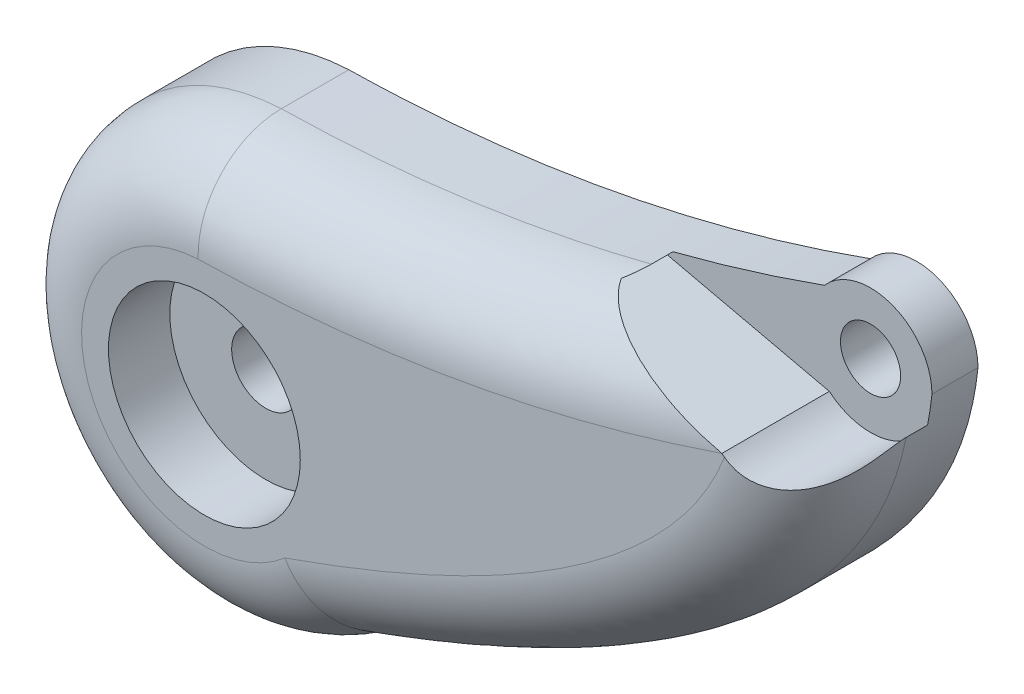
from build123d import *

# Parameters (mm, degrees)
SKETCH1_R           = 1.411527177
SKETCH1_R_2         = 1.243983369
BOSS_EXTRUDE1_DEPTH = 8.89
SKETCH2_R           = 2.645579886
CUT_EXTRUDE1_DEPTH  = 4.445
FILLET1_R           = 3.556
SKETCH3_W           = 44.674996293
SKETCH3_H           = 31.668439698
CUT_EXTRUDE2_DEPTH  = 2.54
SKETCH4_R           = 3.96875
CUT_EXTRUDE3_DEPTH  = 2.54
CUT_EXTRUDE7_DEPTH  = 4.445


with BuildPart() as part:
    # Sketch1 → Boss-Extrude1 (new body)
    with BuildSketch(Plane.XY):
        with BuildLine():
            add(Edge.make_bspline(
                [(21.205268726, 12.646161991), (14.255823247, 10.148268513), (7.187400407, 8.811547849), (0, 8.636)],
                knots=[0.085210597, 0.085210597, 0.085210597, 0.085210597, 0.879863224, 0.879863224, 0.879863224, 0.879863224], degree=3))
            add(Edge.make_bspline(
                [(0, 8.636), (-0.12439204, 8.632961801), (-0.248819718, 8.630271408), (-0.373283033, 8.627928823)],
                knots=[0.879863224, 0.879863224, 0.879863224, 0.879863224, 0.893616244, 0.893616244, 0.893616244, 0.893616244], degree=3))
            ThreePointArc((-0.373283033, 8.627928823), (-8.155941991, -2.839208736), (5.065163845, -6.994613014))
            add(Edge.make_bspline(
                [(5.065163845, -6.994613014), (17.65304868, -2.514917498), (24.488656608, 3.25999298), (25.571987628, 10.33011842)],
                knots=[0.06260201, 0.06260201, 0.06260201, 0.06260201, 0.556375894, 0.556375894, 0.556375894, 0.556375894], degree=3))
            add(Edge.make_bspline(
                [(25.571987628, 10.33011842), (25.604508953, 10.542361808), (25.63184641, 10.755772424), (25.654, 10.97035027)],
                knots=[0.556375894, 0.556375894, 0.556375894, 0.556375894, 0.571198862, 0.571198862, 0.571198862, 0.571198862], degree=3))
            ThreePointArc((25.654, 10.97035027), (24.009383316, 13.347299726), (21.205268726, 12.646161991))
        make_face()
        Circle(SKETCH1_R, mode=Mode.SUBTRACT)
        with Locations((23.114, 10.97035027)):
            Circle(SKETCH1_R_2, mode=Mode.SUBTRACT)
    extrude(amount=BOSS_EXTRUDE1_DEPTH)

    # Sketch2 → Cut-Extrude1 (cut)
    with BuildSketch(Plane.XY.offset(8.89)):
        with Locations((23.114, 10.97035027)):
            Circle(SKETCH2_R)
    extrude(amount=-CUT_EXTRUDE1_DEPTH, mode=Mode.SUBTRACT)

    # Fillet1
    fillet1_edges = [part.edges().sort_by_distance(p)[0] for p in [
        (10.663514179, 9.764845798, 8.89),
        (-8.155941991, -2.839208736, 8.89),
        (17.427402091, -0.984924283, 8.89),
    ]]
    fillet(fillet1_edges, radius=FILLET1_R)

    # Sketch3 → Cut-Extrude2 (cut)
    with BuildSketch(Plane(origin=(0, 0, 0), x_dir=(-1, 0, 0), z_dir=(0, 0, -1))):
        with Locations((-8.365824592, 1.646921095)):
            Rectangle(SKETCH3_W, SKETCH3_H)
    extrude(amount=-CUT_EXTRUDE2_DEPTH, mode=Mode.SUBTRACT)

    # Sketch4 → Cut-Extrude3 (cut)
    with BuildSketch(Plane.XY.offset(8.89)):
        Circle(SKETCH4_R)
    extrude(amount=-CUT_EXTRUDE3_DEPTH, mode=Mode.SUBTRACT)

    # Sketch9 → Cut-Extrude7 (cut)
    with BuildSketch(Plane.XY.offset(8.89)):
        Polygon((21.408086702, 8.948234361), (14.616524105, 10.508926006), (20.791087942, 14.493017593), (23.324721169, 10.827396362), align=None)
    extrude(amount=-CUT_EXTRUDE7_DEPTH, mode=Mode.SUBTRACT)


solid = part.part
